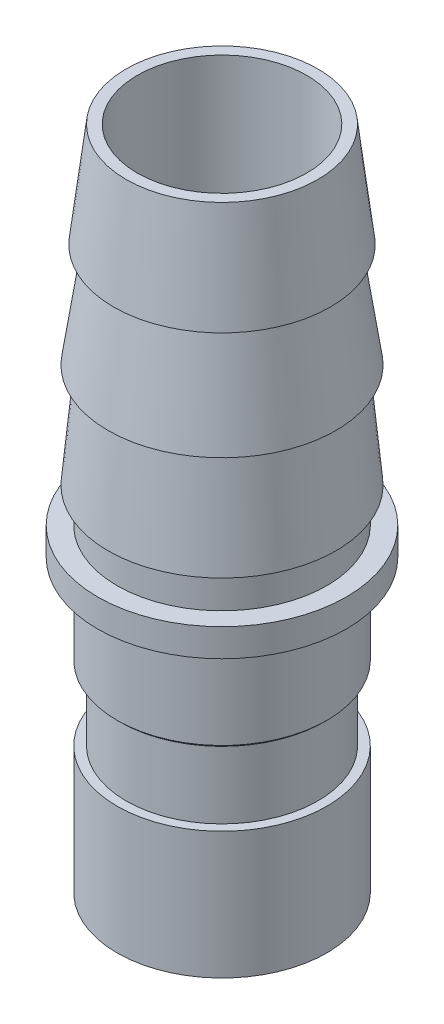
from build123d import *


with BuildPart() as part:
    # Sketch3 → Revolve1 (revolve)
    with BuildSketch(Plane.XY, mode=Mode.PRIVATE) as revolve1_sk:
        Polygon((7.55, 5), (7.55, 14.15), (6.9, 14.15), (6.9, 19.3), (7.35, 19.3), (7.55, 19.5), (7.55, 25.89571665), (8.95, 25.89571665), (8.95, 27.89571665), (7.55, 27.89571665), (7.55, 30.39571665), (8.2, 30.39571665), (7.5, 37.89571665), (8.2, 37.89571665), (7.1, 45.39571665), (7.8, 45.39571665), (6.9, 52.89571665), (6.1, 52.89571665), (6.1, 5), align=None)
    revolve(revolve1_sk.sketch.rotate(Axis((0, 70.39571665, 0), (0, -1, 0)), 90), axis=Axis((0, 70.39571665, 0), (0, -1, 0)))


solid = part.part
